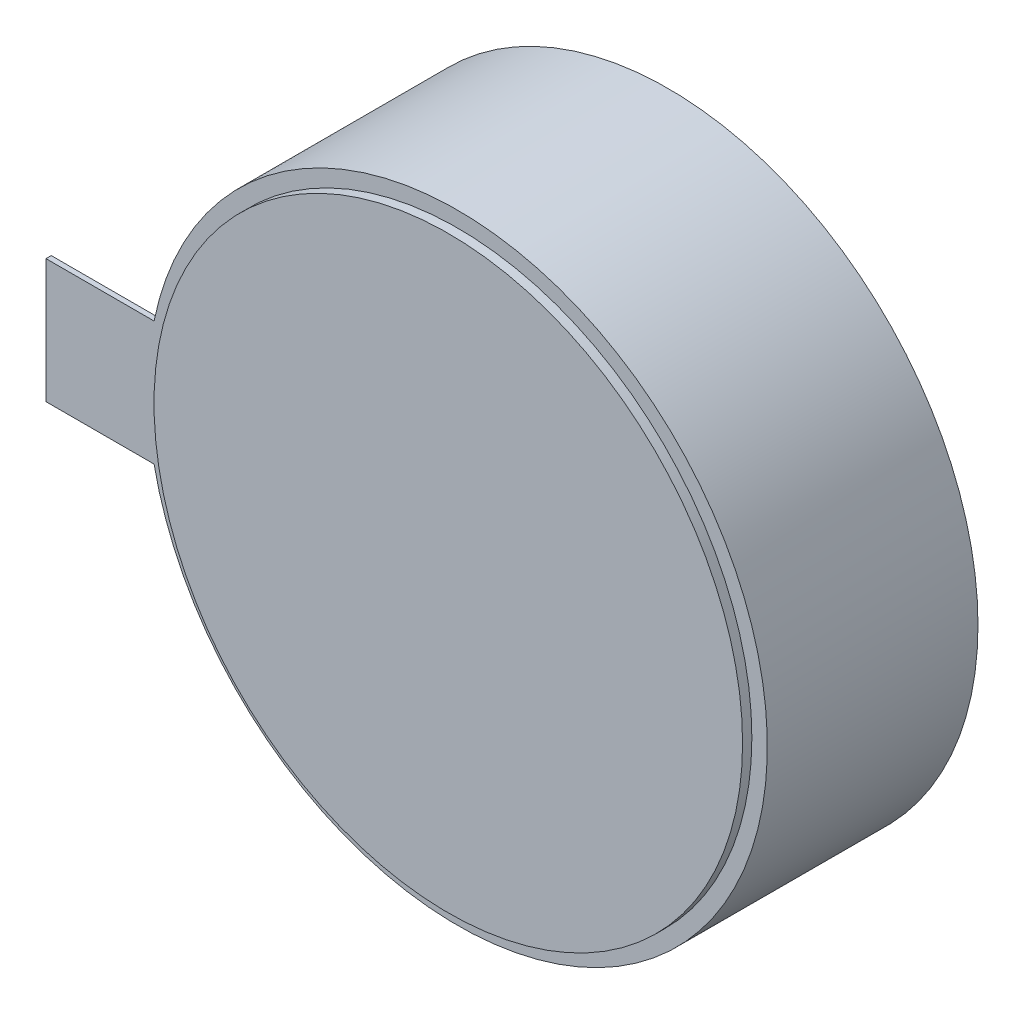
from build123d import *

# Parameters (mm, degrees)
SKETCH1_R           = 5
BOSS_EXTRUDE1_DEPTH = 3.4
SKETCH2_R           = 4.75
BOSS_EXTRUDE2_DEPTH = 0.15
BOSS_EXTRUDE3_START = -0.085
BOSS_EXTRUDE3_DEPTH = 0.085


with BuildPart() as part:
    # Sketch1 → Boss-Extrude1 (new body)
    with BuildSketch(Plane.XY):
        Circle(SKETCH1_R)
    extrude(amount=BOSS_EXTRUDE1_DEPTH)

    # Sketch2 → Boss-Extrude2 (add)
    with BuildSketch(Plane.XY.offset(3.4)):
        Circle(SKETCH2_R)
    extrude(amount=BOSS_EXTRUDE2_DEPTH)

    # Sketch4 → Boss-Extrude3 (add)
    with BuildSketch(Plane.XY.offset(3.4).offset(BOSS_EXTRUDE3_START)):
        with BuildLine():
            Line((-4.643543905, 1), (-6.643543905, 1))
            Line((-6.643543905, 1), (-6.643543905, -1))
            Line((-6.643543905, -1), (-4.643543905, -1))
            ThreePointArc((-4.643543905, -1), (-4.75, 0), (-4.643543905, 1))
        make_face()
    extrude(amount=BOSS_EXTRUDE3_DEPTH)


solid = part.part
